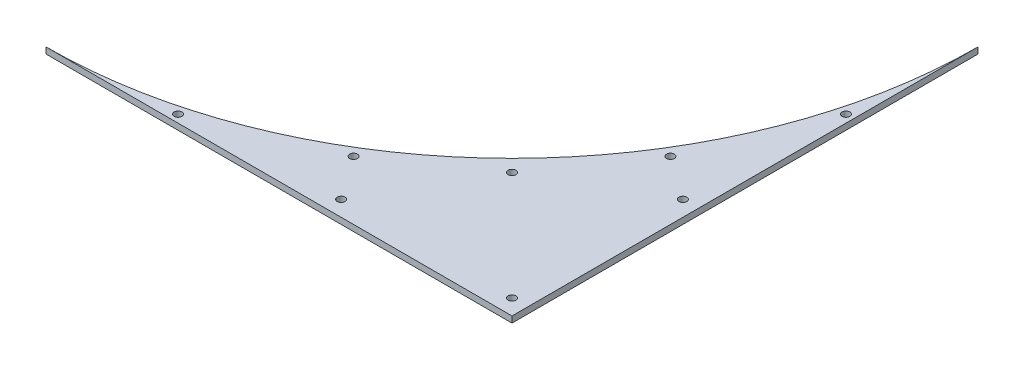
from build123d import *

# Parameters (mm, degrees)
BOSS_EXTRUDE1_DEPTH = 5.08
SKETCH3_R           = 3.175
CUT_EXTRUDE1_DEPTH  = 5.08


with BuildPart() as part:
    # Sketch1 → Boss-Extrude1 (new body)
    with BuildSketch(Plane(origin=(0, 0, 0), x_dir=(1, 0, 0), z_dir=(0, 1, 0))):
        with BuildLine():
            Line((381, 0), (381, 381))
            ThreePointArc((381, 381), (269.407683632, 111.592316368), (0, 0))
            Line((0, 0), (381, 0))
        make_face()
    extrude(amount=BOSS_EXTRUDE1_DEPTH)

    # Sketch3 → Cut-Extrude1 (cut)
    with BuildSketch(Plane(origin=(0, 5.08, 0), x_dir=(1, 0, 0), z_dir=(0, 1, 0))):
        with Locations(Location((101.6, 6.35, 0), (0, 0, 270))):
            Circle(SKETCH3_R)
        with Locations(Location((374.65, 279.4, 0), (0, 0, 270))):
            Circle(SKETCH3_R)
        with Locations(Location((368.3, 12.7, 0), (0, 0, 270))):
            Circle(SKETCH3_R)
        with Locations(Location((279.4, 101.6, 0), (0, 0, 270))):
            Circle(SKETCH3_R)
        with Locations(Location((203.2, 48.26, 0), (0, 0, 270))):
            Circle(SKETCH3_R)
        with Locations(Location((332.74, 177.8, 0), (0, 0, 270))):
            Circle(SKETCH3_R)
        with Locations(Location((228.6, 12.7, 0), (0, 0, 270))):
            Circle(SKETCH3_R)
        with Locations(Location((368.3, 152.4, 0), (0, 0, 270))):
            Circle(SKETCH3_R)
    extrude(amount=-CUT_EXTRUDE1_DEPTH, mode=Mode.SUBTRACT)


solid = part.part
